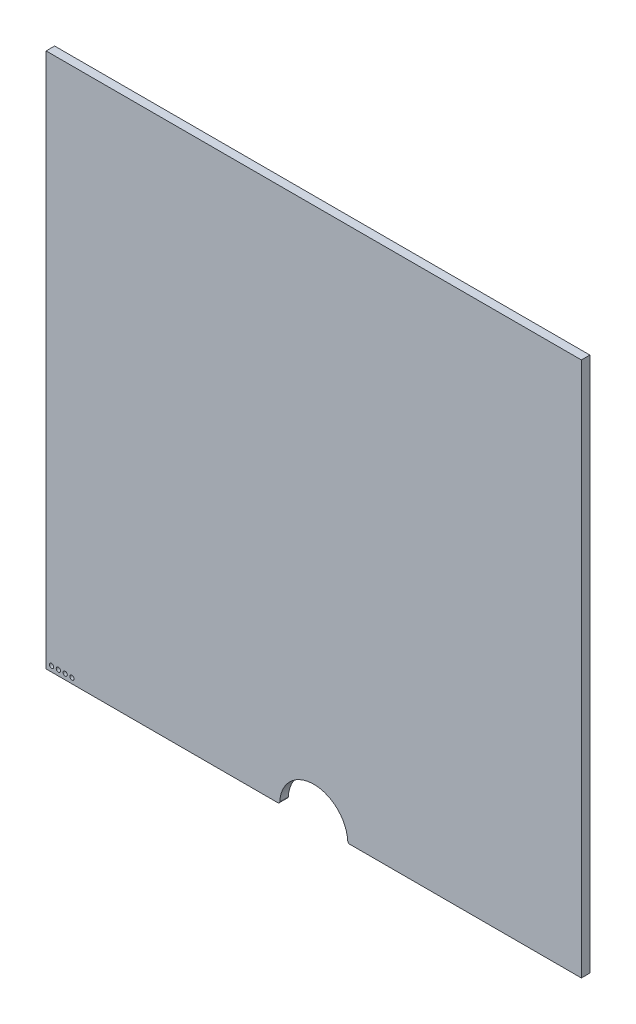
from build123d import *

# Parameters (mm, degrees)
SKETCH1_W           = 200
SKETCH1_H           = 200
BOSS_EXTRUDE1_DEPTH = 3.175
SKETCH5_W           = 200
SKETCH5_H           = 200
SKETCH5_W_2         = 199.8984
SKETCH5_H_2         = 199.8984
CUT_EXTRUDE2_DEPTH  = 283.860532109
CUT_EXTRUDE1_DEPTH  = 3.175
FILLET1_R           = 0.79375
SKETCH6_R           = 0.79375
CUT_EXTRUDE3_DEPTH  = 1.27
LPATTERN1_COUNT     = 4
LPATTERN1_PITCH     = 2.54


with BuildPart() as part:
    # Sketch1 → Boss-Extrude1 (new body)
    with BuildSketch(Plane.XY):
        with Locations((100, 100)):
            Rectangle(SKETCH1_W, SKETCH1_H)
    extrude(amount=BOSS_EXTRUDE1_DEPTH)

    # Sketch5 → Cut-Extrude2 (cut, through all)
    with BuildSketch(Plane.XY.offset(3.175)):
        with Locations((100, 100)):
            Rectangle(SKETCH5_W, SKETCH5_H)
        with Locations((100, 100)):
            Rectangle(SKETCH5_W_2, SKETCH5_H_2, mode=Mode.SUBTRACT)
    extrude(amount=-CUT_EXTRUDE2_DEPTH, mode=Mode.SUBTRACT)

    # Sketch2 → Cut-Extrude1 (cut)
    with BuildSketch(Plane.XY.offset(3.175)):
        with BuildLine():
            Line((87.3, 0.0508), (112.7, 0.0508))
            ThreePointArc((112.7, 0.0508), (100, 12.7508), (87.3, 0.0508))
        make_face()
    extrude(amount=-CUT_EXTRUDE1_DEPTH, mode=Mode.SUBTRACT)

    # Fillet1
    fillet1_edges = [part.edges().sort_by_distance(p)[0] for p in [
        (87.3, 0.0508, 1.5875),
        (112.7, 0.0508, 1.5875),
    ]]
    fillet(fillet1_edges, radius=FILLET1_R)

    # Sketch6 → Cut-Extrude3 (cut)
    with BuildSketch(Plane.XY.offset(3.175)):
        with Locations((2.0828, 2.0828)):
            Circle(SKETCH6_R)
    cut_extrude3 = extrude(amount=-CUT_EXTRUDE3_DEPTH, mode=Mode.SUBTRACT)

    # LPattern1: Cut-Extrude3 ×4
    with Locations(*[(i * LPATTERN1_PITCH, 0, 0) for i in range(1, LPATTERN1_COUNT)]):
        add(cut_extrude3, mode=Mode.SUBTRACT)


solid = part.part
